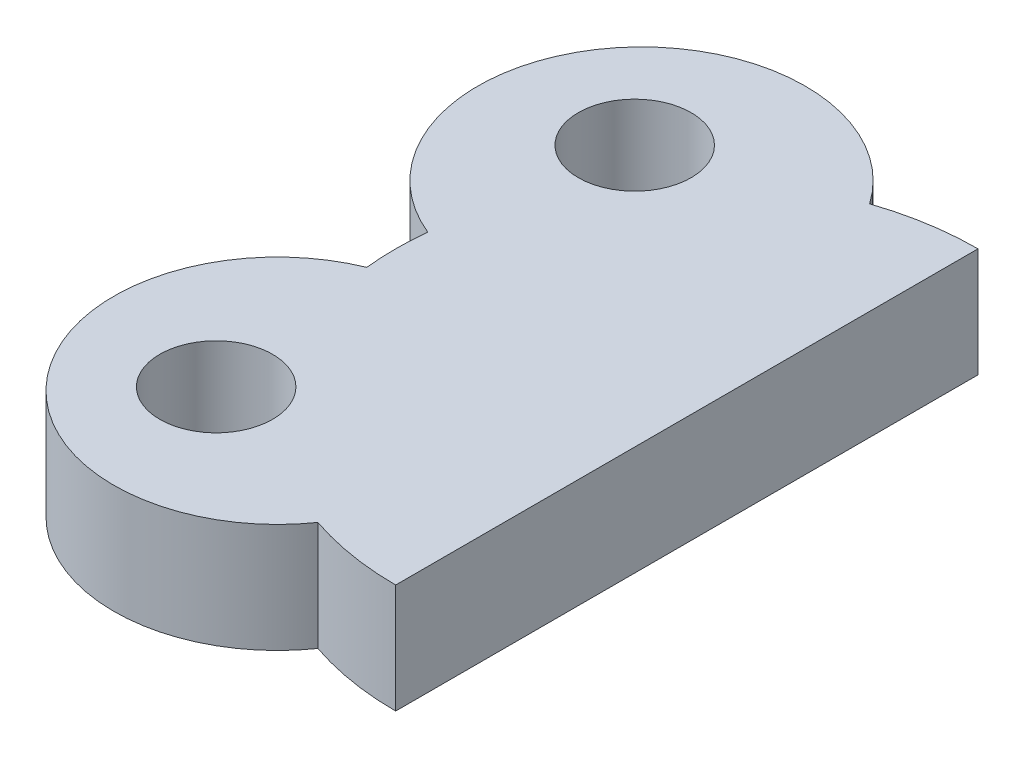
from build123d import *

# Parameters (mm, degrees)
EXTRUDE_1_DEPTH     = 3
SKETCH_2_R          = 1.55
CUT_EXTRUDE_1_DEPTH = 24.464866076


with BuildPart() as part:
    # 草图1 → 凸台-拉伸1 (new body)
    with BuildSketch(Plane(origin=(0, 0, 0), x_dir=(1, 0, 0), z_dir=(0, 1, 0))):
        with BuildLine():
            Line((-10.5, 8), (-10.5, -8))
            ThreePointArc((-10.5, -8), (-11.796148944, -7.89430161), (-13.058047675, -7.579999479))
            ThreePointArc((-13.058047675, -7.579999479), (-20.257809372, -7.8125), (-18.455991924, -0.837969271))
            ThreePointArc((-18.455991924, -0.837969271), (-18.5, 0), (-18.455991924, 0.837969271))
            ThreePointArc((-18.455991924, 0.837969271), (-20.257809372, 7.8125), (-13.058047675, 7.579999479))
            ThreePointArc((-13.058047675, 7.579999479), (-11.796148944, 7.89430161), (-10.5, 8))
        make_face()
    extrude(amount=EXTRUDE_1_DEPTH)

    # 草图2 → 切除-拉伸1 (cut, through all)
    with BuildSketch(Plane(origin=(0, 3, 0), x_dir=(1, 0, 0), z_dir=(0, 1, 0))):
        with Locations(Location((-17.681747698, 5.75, 0), (0, 0, 270))):
            Circle(SKETCH_2_R)
        with Locations(Location((-17.681747698, -5.75, 0), (0, 0, 270))):
            Circle(SKETCH_2_R)
    extrude(amount=-CUT_EXTRUDE_1_DEPTH, mode=Mode.SUBTRACT)


solid = part.part
